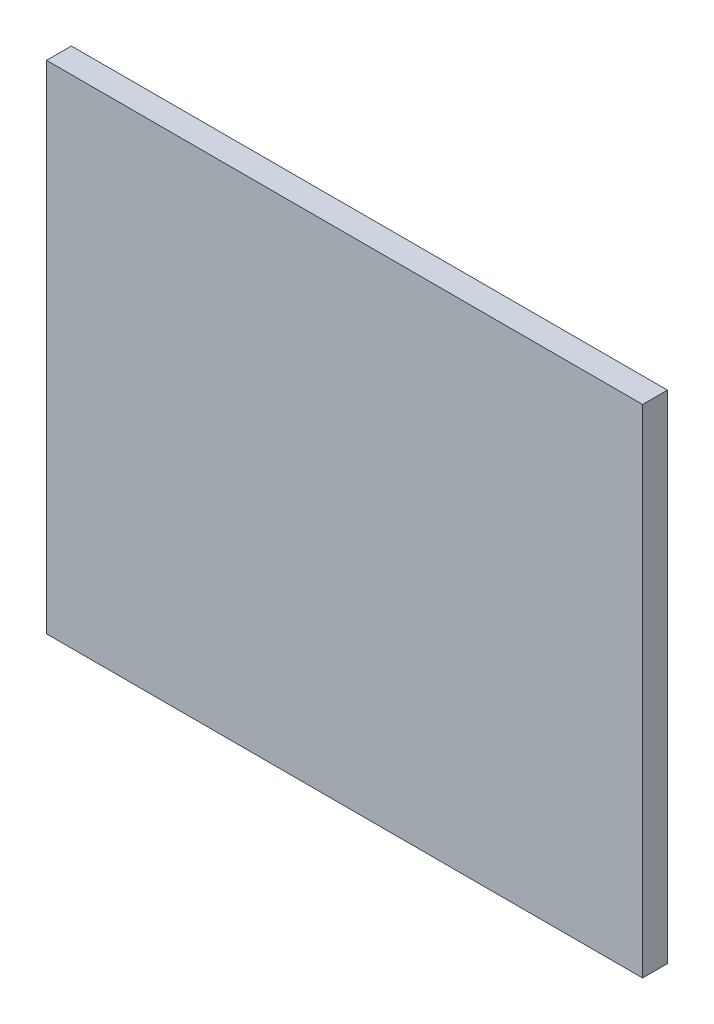
from build123d import *

# Parameters (mm, degrees)
ESQUISSE1_W                = 28.3
ESQUISSE1_H                = 28.3
ESQUISSE1_W_2              = 20.3
ESQUISSE1_H_2              = 20.3
ESQUISSE1_W_3              = 4
ESQUISSE1_H_3              = 2
BOSS_EXTRU_1_DEPTH         = 20
BOSS_EXTRU_7_DEPTH         = 20
ESQUISSE2_W                = 8.5
ESQUISSE2_H                = 20
ESQUISSE2_R                = 1.7
BOSS_EXTRU_2_DEPTH         = 2
ESQUISSE2_3_W              = 8.5
ESQUISSE2_3_H              = 20
BOSS_EXTRU_3_DEPTH         = 3
ESQUISSE3_W                = 8.5
ESQUISSE3_H                = 20
ESQUISSE3_R                = 1.7
BOSS_EXTRU_4_DEPTH         = 2
ESQUISSE5_W                = 8.5
ESQUISSE5_H                = 20
ESQUISSE5_R                = 3
BOSS_EXTRU_5_DEPTH         = 2
BOSS_EXTRU_6_DEPTH         = 20
BOSS_EXTRU_6_DEPTH_BACK    = 20
ESQUISSE6_W                = 28.3
ESQUISSE6_H                = 28.3
ESQUISSE6_W_2              = 15.3
ESQUISSE6_H_2              = 15.3
ENL_V_MAT_EXTRU_1_REACH    = 68.678
ESQUISSE7_W                = 6.5
ESQUISSE7_H                = 2
ENL_V_MAT_EXTRU_2_REACH    = 65.341
ESQUISSE8_W                = 14.15
ESQUISSE8_H                = 2
ESQUISSE9_W                = 8.5
ESQUISSE9_H                = 40
BOSS_EXTRU_8_DEPTH         = 5
ESQUISSE9_4_R              = 1.7
BOSS_EXTRU_9_DEPTH         = 2
BOSS_EXTRU_10_START        = -2
ESQUISSE10_W               = 8.5
ESQUISSE10_H               = 40
ESQUISSE10_R               = 1.7
BOSS_EXTRU_10_DEPTH        = 2
ESQUISSE11_W               = 8.5
ESQUISSE11_H               = 40
ESQUISSE11_R               = 3
BOSS_EXTRU_11_DEPTH        = 2
NERVURE4_REACH             = 68.678
ESQUISSE14_WALL_W          = 147.131281186
ESQUISSE14_WALL_H          = 5
NERVURE10_REACH            = 68.678
ESQUISSE16_WALL_W          = 147.844247416
ESQUISSE16_WALL_H          = 5
R_P_TITION_LIN_AIRE1_COUNT = 3
R_P_TITION_LIN_AIRE1_PITCH = 17.5
NERVURE11_REACH            = 76.685
ESQUISSE17_WALL_W          = 163.85974229
ESQUISSE17_WALL_H          = 5
NERVURE17_REACH            = 58.973
ESQUISSE19_WALL_W          = 127.721749296
ESQUISSE19_WALL_H          = 5
R_P_TITION_LIN_AIRE2_COUNT = 2
R_P_TITION_LIN_AIRE2_PITCH = 15
R_P_TITION_LIN_AIRE3_COUNT = 2
R_P_TITION_LIN_AIRE3_PITCH = 15
ENL_V_MAT_EXTRU_3_REACH    = 52.13
ESQUISSE20_W               = 77.833771897
ESQUISSE20_H               = 63.25162408
ESQUISSE21_W               = 120
ESQUISSE21_H               = 100
BOSS_EXTRU_12_DEPTH        = 5
CHANFREIN1_SIZE            = 10


with BuildPart() as part:
    # Esquisse1 → Boss.-Extru.1 (new body)
    # profile 1 of 2: a face of its own
    with BuildSketch(Plane.XY):
        Rectangle(ESQUISSE1_W, ESQUISSE1_H)
        Rectangle(ESQUISSE1_W_2, ESQUISSE1_H_2, mode=Mode.SUBTRACT)
    # profile 2 of 2: a face of its own
    with BuildSketch(Plane.XY):
        with Locations((12.15, -1)):
            Rectangle(ESQUISSE1_W_3, ESQUISSE1_H_3)
    extrude(amount=BOSS_EXTRU_1_DEPTH)

    # Esquisse1<3> → Boss.-Extru.7 (add)
    with BuildSketch(Plane.XY):
        Polygon((14.15, 14.15), (-14.15, 14.15), (-14.15, -14.15), (14.15, -14.15), (14.15, -2), (10.15, -2), (10.15, -10.15), (-10.15, -10.15), (-10.15, 10.15), (10.15, 10.15), (10.15, 0), (14.15, 0), align=None)
    extrude(amount=-BOSS_EXTRU_7_DEPTH)

    # Esquisse2 → Boss.-Extru.2 (add)
    with BuildSketch(Plane(origin=(0, 2, 0), x_dir=(-1, 0, 0), z_dir=(0, -1, 0))):
        with Locations((-18.4, 10)):
            Rectangle(ESQUISSE2_W, ESQUISSE2_H)
        with Locations(Location((-18.4, 10, 0), (0, 0, 180))):
            Circle(ESQUISSE2_R, mode=Mode.SUBTRACT)
    extrude(amount=BOSS_EXTRU_2_DEPTH)

    # Esquisse2<3> → Boss.-Extru.3 (add)
    with BuildSketch(Plane(origin=(0, 2, 0), x_dir=(-1, 0, 0), z_dir=(0, -1, 0))):
        with Locations((-18.4, 10)):
            Rectangle(ESQUISSE2_3_W, ESQUISSE2_3_H)
        Polygon((-15.65, 11.58771324), (-15.65, 8.41228676), (-18.4, 6.824573519), (-21.15, 8.41228676), (-21.15, 11.58771324), (-18.4, 13.175426481), align=None, mode=Mode.SUBTRACT)
    extrude(amount=-BOSS_EXTRU_3_DEPTH)

    # Esquisse3 → Boss.-Extru.4 (add)
    with BuildSketch(Plane(origin=(0, -2, 0), x_dir=(1, 0, 0), z_dir=(0, 1, 0))):
        with Locations((18.4, 10)):
            Rectangle(ESQUISSE3_W, ESQUISSE3_H)
        with Locations((18.4, 10)):
            Circle(ESQUISSE3_R, mode=Mode.SUBTRACT)
    extrude(amount=-BOSS_EXTRU_4_DEPTH)

    # Esquisse5 → Boss.-Extru.5 (add)
    with BuildSketch(Plane.XZ.offset(4)):
        with Locations((18.4, -10)):
            Rectangle(ESQUISSE5_W, ESQUISSE5_H)
        with Locations((18.4, -10)):
            Circle(ESQUISSE5_R, mode=Mode.SUBTRACT)
    extrude(amount=BOSS_EXTRU_5_DEPTH)

    # Esquisse6 → Boss.-Extru.6 (add, two sides: drawn at the far end of the back side and taken through both)
    with BuildSketch(Plane(origin=(0, 0, 0), x_dir=(-1, 0, 0), z_dir=(0, -1, 0)).offset(-BOSS_EXTRU_6_DEPTH_BACK)):
        with Locations((0, -34.15)):
            Rectangle(ESQUISSE6_W, ESQUISSE6_H)
        with Locations((0, -34.15)):
            Rectangle(ESQUISSE6_W_2, ESQUISSE6_H_2, mode=Mode.SUBTRACT)
    extrude(amount=BOSS_EXTRU_6_DEPTH + BOSS_EXTRU_6_DEPTH_BACK)

    # Esquisse7 → Enlèv. mat.-Extru.1 (cut, up to next)
    with BuildSketch(Plane.XZ.offset(20), mode=Mode.PRIVATE) as enl_v_mat_extru_1_sk1:
        with Locations((10.9, 35.15)):
            Rectangle(ESQUISSE7_W, ESQUISSE7_H)
    enl_v_mat_extru_1_tool1 = extrude(enl_v_mat_extru_1_sk1.sketch, amount=-ENL_V_MAT_EXTRU_1_REACH, mode=Mode.PRIVATE) & part.part
    add(enl_v_mat_extru_1_tool1.solids().sort_by_distance((10.9, -20, 35.15))[0], mode=Mode.SUBTRACT)

    # Esquisse8 → Enlèv. mat.-Extru.2 (cut, up to next)
    with BuildSketch(Plane.XZ.offset(14.15), mode=Mode.PRIVATE) as enl_v_mat_extru_2_sk1:
        with Locations((7.075, 1)):
            Rectangle(ESQUISSE8_W, ESQUISSE8_H)
    enl_v_mat_extru_2_tool1 = extrude(enl_v_mat_extru_2_sk1.sketch, amount=-ENL_V_MAT_EXTRU_2_REACH, mode=Mode.PRIVATE) & part.part
    add(enl_v_mat_extru_2_tool1.solids().sort_by_distance((7.075, -14.15, 1))[0], mode=Mode.SUBTRACT)

    # Esquisse9 → Boss.-Extru.8 (add)
    with BuildSketch(Plane.XY.offset(34.15)):
        with Locations((18.4, 0)):
            Rectangle(ESQUISSE9_W, ESQUISSE9_H)
        Polygon((18.4, 6.824573519), (21.15, 8.41228676), (21.15, 11.58771324), (18.4, 13.175426481), (15.65, 11.58771324), (15.65, 8.41228676), align=None, mode=Mode.SUBTRACT)
        Polygon((18.4, -6.824573519), (21.15, -8.41228676), (21.15, -11.58771324), (18.4, -13.175426481), (15.65, -11.58771324), (15.65, -8.41228676), align=None, mode=Mode.SUBTRACT)
    extrude(amount=-BOSS_EXTRU_8_DEPTH)

    # Esquisse9<4> → Boss.-Extru.9 (add)
    # profile 1 of 2: a face of its own
    with BuildSketch(Plane.XY.offset(34.15)):
        Polygon((15.65, 8.41228676), (18.4, 6.824573519), (21.15, 8.41228676), (21.15, 11.58771324), (18.4, 13.175426481), (15.65, 11.58771324), align=None)
        with Locations((18.4, 10)):
            Circle(ESQUISSE9_4_R, mode=Mode.SUBTRACT)
    # profile 2 of 2: a face of its own
    with BuildSketch(Plane.XY.offset(34.15)):
        Polygon((21.15, -8.41228676), (21.15, -11.58771324), (18.4, -13.175426481), (15.65, -11.58771324), (15.65, -8.41228676), (18.4, -6.824573519), align=None)
        with Locations((18.4, -10)):
            Circle(ESQUISSE9_4_R, mode=Mode.SUBTRACT)
    extrude(amount=-BOSS_EXTRU_9_DEPTH)

    # Esquisse10 → Boss.-Extru.10 (add)
    with BuildSketch(Plane(origin=(0, 0, 36.15), x_dir=(-1, 0, 0), z_dir=(0, 0, -1)).offset(BOSS_EXTRU_10_START)):
        with Locations((-18.4, 0)):
            Rectangle(ESQUISSE10_W, ESQUISSE10_H)
        with Locations(Location((-18.4, -10, 0), (0, 0, 180))):
            Circle(ESQUISSE10_R, mode=Mode.SUBTRACT)
        with Locations(Location((-18.4, 10, 0), (0, 0, 180))):
            Circle(ESQUISSE10_R, mode=Mode.SUBTRACT)
    extrude(amount=BOSS_EXTRU_10_DEPTH)

    # Esquisse11 → Boss.-Extru.11 (add)
    with BuildSketch(Plane.XY.offset(38.15)):
        with Locations((18.4, 0)):
            Rectangle(ESQUISSE11_W, ESQUISSE11_H)
        with Locations((18.4, 10)):
            Circle(ESQUISSE11_R, mode=Mode.SUBTRACT)
        with Locations((18.4, -10)):
            Circle(ESQUISSE11_R, mode=Mode.SUBTRACT)
    extrude(amount=BOSS_EXTRU_11_DEPTH)

    # Esquisse14 wall → Nervure4 (add, up to next)
    with BuildSketch(Plane(origin=(18.4, -20, 44.225), x_dir=(0.721811427095, 0, -0.692089780097), z_dir=(0.692089780097, 0, 0.721811427095)), mode=Mode.PRIVATE) as nervure4_sk1:
        with Locations((0, 2.5)):
            Rectangle(ESQUISSE14_WALL_W, ESQUISSE14_WALL_H)
    nervure4_tool1 = extrude(nervure4_sk1.sketch, amount=-NERVURE4_REACH, mode=Mode.PRIVATE) - part.part
    nervure4 = nervure4_tool1.solids().sort_by_distance((18.4, -20, 44.225))[0]
    add(nervure4)

    # Esquisse16 wall → Nervure10 (add, up to next)
    with BuildSketch(Plane(origin=(18.4, -20, 24.575), x_dir=(-0.680604645507, 0, -0.732650883105), z_dir=(0.732650883105, 0, -0.680604645507)), mode=Mode.PRIVATE) as nervure10_sk1:
        with Locations((0, 2.5)):
            Rectangle(ESQUISSE16_WALL_W, ESQUISSE16_WALL_H)
    nervure10_tool1 = extrude(nervure10_sk1.sketch, amount=-NERVURE10_REACH, mode=Mode.PRIVATE) - part.part
    nervure10 = nervure10_tool1.solids().sort_by_distance((18.4, -20, 24.575))[0]
    add(nervure10)

    # Répétition linéaire1: Nervure4, Nervure10 ×3
    with Locations(*[(0, i * R_P_TITION_LIN_AIRE1_PITCH, 0) for i in range(1, R_P_TITION_LIN_AIRE1_COUNT)]):
        add(nervure4)
        add(nervure10)

    # Esquisse17 wall → Nervure11 (add, up to next)
    with BuildSketch(Plane(origin=(18.4, 9.575, -20), x_dir=(-0.680604645507, 0.732650883105, 0), z_dir=(0.732650883105, 0.680604645507, 0)), mode=Mode.PRIVATE) as nervure11_sk1:
        with Locations((0, 2.5)):
            Rectangle(ESQUISSE17_WALL_W, ESQUISSE17_WALL_H)
    nervure11_tool1 = extrude(nervure11_sk1.sketch, amount=-NERVURE11_REACH, mode=Mode.PRIVATE) - part.part
    nervure11 = nervure11_tool1.solids().sort_by_distance((18.4, 9.575, -20))[0]
    add(nervure11)

    # Esquisse19 wall → Nervure17 (add, up to next)
    with BuildSketch(Plane(origin=(18.4, -10.075, 0), x_dir=(-0.721811427095, -0.692089780097, 0), z_dir=(0.692089780097, -0.721811427095, 0)), mode=Mode.PRIVATE) as nervure17_sk1:
        with Locations((0, 2.5)):
            Rectangle(ESQUISSE19_WALL_W, ESQUISSE19_WALL_H)
    nervure17_tool1 = extrude(nervure17_sk1.sketch, amount=-NERVURE17_REACH, mode=Mode.PRIVATE) - part.part
    nervure17 = nervure17_tool1.solids().sort_by_distance((18.4, -10.075, 0))[0]
    add(nervure17)

    # Répétition linéaire2: Nervure17 ×2
    with Locations(*[(0, 0, -i * R_P_TITION_LIN_AIRE2_PITCH) for i in range(1, R_P_TITION_LIN_AIRE2_COUNT)]):
        add(nervure17)

    # Répétition linéaire3: Nervure11 ×2
    with Locations(*[(0, 0, i * R_P_TITION_LIN_AIRE3_PITCH) for i in range(1, R_P_TITION_LIN_AIRE3_COUNT)]):
        add(nervure11)

    # Esquisse20 → Enlèv. mat.-Extru.3 (cut, up to next)
    with BuildSketch(Plane(origin=(0, 0, 20), x_dir=(-1, 0, 0), z_dir=(0, 0, -1)), mode=Mode.PRIVATE) as enl_v_mat_extru_3_sk1:
        with Locations((6.593135557, -7.228757038)):
            Rectangle(ESQUISSE20_W, ESQUISSE20_H)
    enl_v_mat_extru_3_tool1 = extrude(enl_v_mat_extru_3_sk1.sketch, amount=-ENL_V_MAT_EXTRU_3_REACH, mode=Mode.PRIVATE) & part.part
    add(enl_v_mat_extru_3_tool1.solids().sort_by_distance((-6.593136, -7.228757, 20))[0], mode=Mode.SUBTRACT)

    # Esquisse21 → Boss.-Extru.12 (add)
    with BuildSketch(Plane.XY.offset(20)):
        with Locations((9.5, 35)):
            Rectangle(ESQUISSE21_W, ESQUISSE21_H)
    extrude(amount=BOSS_EXTRU_12_DEPTH)

    # Chanfrein1
    chanfrein1_edges = [part.edges().sort_by_distance(p)[0] for p in [
        (0, 14.15, 20),
        (14.15, 0, 20),
        (-14.15, 0, 20),
    ]]
    chamfer(chanfrein1_edges, length=CHANFREIN1_SIZE)


solid = part.part
